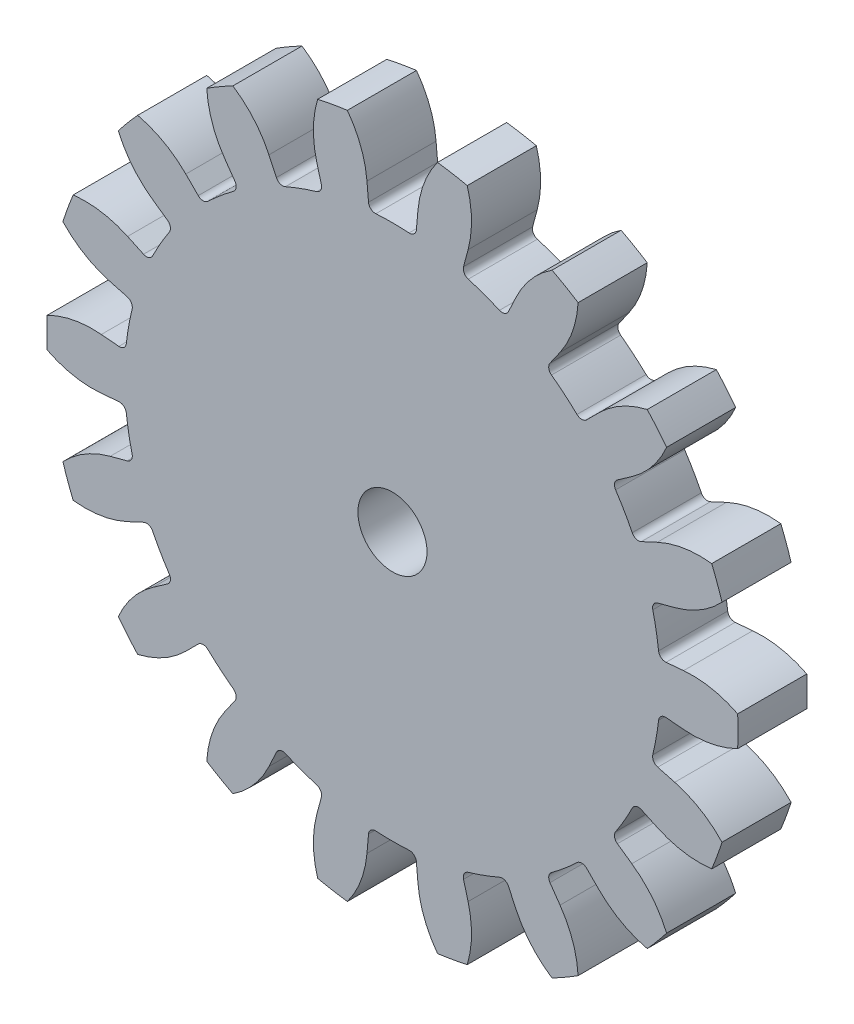
from build123d import *

# Parameters (mm, degrees)
BOSS_EXTRUDE1_DEPTH      = 10
FILLET1_R                = 1
CIRPATTERN2_COUNT        = 18
FILLET1_OF_CIRPATTERN2_R = 1


with BuildPart() as part:
    # Sketch1 → Boss-Extrude1 (new body)
    with BuildSketch(Plane.XY):
        with BuildLine():
            Line((4.924038765, 0.868240888), (38.161300429, 6.728866885))
            ThreePointArc((38.161300429, 6.728866885), (38.418488378, 5.057889949), (38.602544551, 3.377285031))
            Line((38.602544551, 3.377285031), (42.124092809, 3.685380582))
            ThreePointArc((42.124092809, 3.685380582), (46.143152518, 3.4790331), (49.952411079, 2.180969368))
            ThreePointArc((49.952411079, 2.180969368), (50, 0), (49.952411079, -2.180969368))
            ThreePointArc((49.952411079, -2.180969368), (46.143152518, -3.4790331), (42.124092809, -3.685380582))
            Line((42.124092809, -3.685380582), (38.602544551, -3.377285031))
            ThreePointArc((38.602544551, -3.377285031), (38.418488378, -5.057889949), (38.161300429, -6.728866885))
            Line((38.161300429, -6.728866885), (4.924038765, -0.868240888))
            ThreePointArc((4.924038765, -0.868240888), (5, 0), (4.924038765, 0.868240888))
        make_face()
    boss_extrude1 = extrude(amount=BOSS_EXTRUDE1_DEPTH)

    # Fillet1
    fillet1_edges = [part.edges().sort_by_distance(p)[0] for p in [
        (38.602544551, -3.377285031, 5),
        (38.602544551, 3.377285031, 5),
    ]]
    fillet(fillet1_edges, radius=FILLET1_R)

    # CirPattern2: Boss-Extrude1 ×18 about axis
    cirpattern2_axis = Axis((0, 0, 0), (0, 0, 1))
    for i in range(1, CIRPATTERN2_COUNT):
        add(boss_extrude1.rotate(cirpattern2_axis, i * 360 / CIRPATTERN2_COUNT))

    # Fillet1 of CirPattern2
    fillet1_of_cirpattern2_edges = [part.edges().sort_by_distance(p)[0] for p in [
        (37.429625769, 10.029237998, 5),
        (35.119426748, 16.376457642, 5),
        (31.742141716, 22.226086909, 5),
        (27.400387771, 27.400387771, 5),
        (22.226086909, 31.742141716, 5),
        (16.376457642, 35.119426748, 5),
        (10.029237998, 37.429625769, 5),
        (3.377285031, 38.602544551, 5),
        (-3.377285031, 38.602544551, 5),
        (-10.029237998, 37.429625769, 5),
        (-16.376457642, 35.119426748, 5),
        (-22.226086909, 31.742141716, 5),
        (-27.400387771, 27.400387771, 5),
        (-31.742141716, 22.226086909, 5),
        (-35.119426748, 16.376457642, 5),
        (-37.429625769, 10.029237998, 5),
        (-38.602544551, 3.377285031, 5),
        (-38.602544551, -3.377285031, 5),
        (-37.429625769, -10.029237998, 5),
        (-35.119426748, -16.376457642, 5),
        (-31.742141716, -22.226086909, 5),
        (-27.400387771, -27.400387771, 5),
        (-22.226086909, -31.742141716, 5),
        (-16.376457642, -35.119426748, 5),
        (-10.029237998, -37.429625769, 5),
        (-3.377285031, -38.602544551, 5),
        (3.377285031, -38.602544551, 5),
        (10.029237998, -37.429625769, 5),
        (16.376457642, -35.119426748, 5),
        (22.226086909, -31.742141716, 5),
        (27.400387771, -27.400387771, 5),
        (31.742141716, -22.226086909, 5),
        (35.119426748, -16.376457642, 5),
        (37.429625769, -10.029237998, 5),
    ]]
    fillet(fillet1_of_cirpattern2_edges, radius=FILLET1_OF_CIRPATTERN2_R)


solid = part.part
